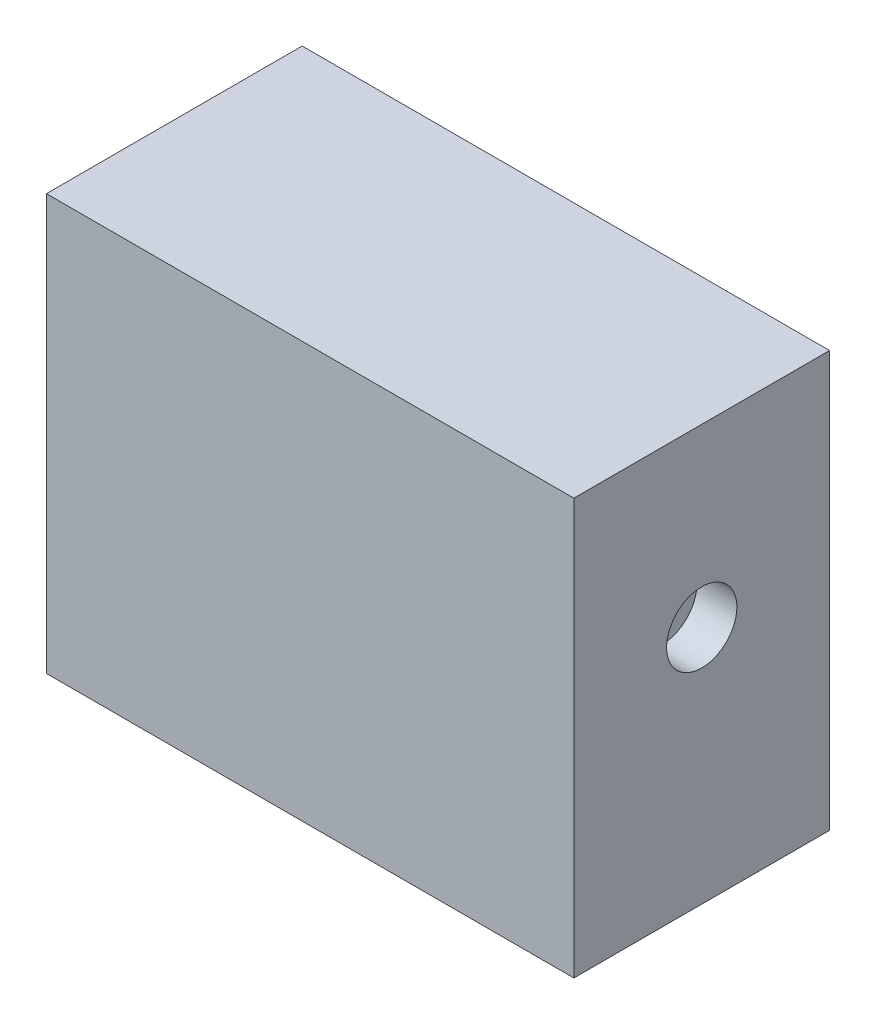
from build123d import *

# Parameters (mm, degrees)
SKETCH1_W           = 330
SKETCH1_H           = 160
BOSS_EXTRUDE1_DEPTH = 260
SKETCH2_R           = 22
CUT_EXTRUDE1_DEPTH  = 25
SKETCH3_R           = 4.7625
CUT_EXTRUDE2_DEPTH  = 10


with BuildPart() as part:
    # Sketch1 → Boss-Extrude1 (new body)
    with BuildSketch(Plane(origin=(0, 0, 0), x_dir=(1, 0, 0), z_dir=(0, 1, 0))):
        Rectangle(SKETCH1_W, SKETCH1_H)
    extrude(amount=BOSS_EXTRUDE1_DEPTH)

    # Sketch2 → Cut-Extrude1 (cut)
    with BuildSketch(Plane(origin=(165, 0, 0), x_dir=(0, 0, -1), z_dir=(1, 0, 0))):
        with Locations((0, 150)):
            Circle(SKETCH2_R)
    extrude(amount=-CUT_EXTRUDE1_DEPTH, mode=Mode.SUBTRACT)

    # Sketch3 → Cut-Extrude2 (cut)
    with BuildSketch(Plane.XZ):
        with Locations((82, 0)):
            Circle(SKETCH3_R)
        with Locations((32, 0)):
            Circle(SKETCH3_R)
        with Locations((-18, 0)):
            Circle(SKETCH3_R)
    extrude(amount=-CUT_EXTRUDE2_DEPTH, mode=Mode.SUBTRACT)


solid = part.part
